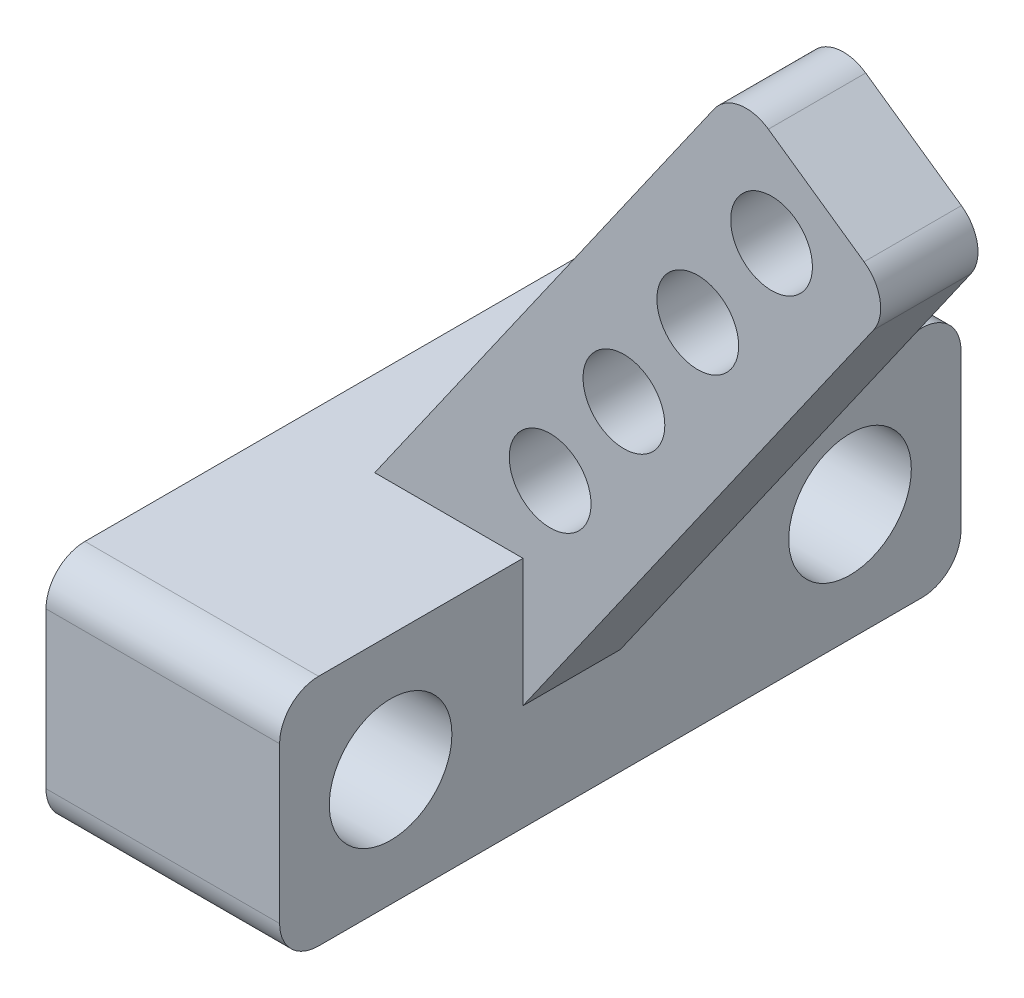
from build123d import *

# Parameters (mm, degrees)
SKETCH1_R           = 3.15
BOSS_EXTRUDE1_DEPTH = 12
SKETCH2_R           = 2.1
BOSS_EXTRUDE2_DEPTH = 5


with BuildPart() as part:
    # Sketch1 → Boss-Extrude1 (new body)
    with BuildSketch(Plane(origin=(0, 0, 0), x_dir=(0, 0, -1), z_dir=(1, 0, 0))):
        with BuildLine():
            Line((-15.5, -6), (15.5, -6))
            ThreePointArc((15.5, -6), (16.914213562, -5.414213562), (17.5, -4))
            Line((17.5, -4), (17.5, 4))
            ThreePointArc((17.5, 4), (16.914213562, 5.414213562), (15.5, 6))
            Line((15.5, 6), (-15.5, 6))
            ThreePointArc((-15.5, 6), (-16.914213562, 5.414213562), (-17.5, 4))
            Line((-17.5, 4), (-17.5, -4))
            ThreePointArc((-17.5, -4), (-16.914213562, -5.414213562), (-15.5, -6))
        make_face()
        with Locations((-11.8, 0)):
            Circle(SKETCH1_R, mode=Mode.SUBTRACT)
        with Locations((11.8, 0)):
            Circle(SKETCH1_R, mode=Mode.SUBTRACT)
    extrude(amount=BOSS_EXTRUDE1_DEPTH)

    # Sketch2 → Boss-Extrude2 (add)
    with BuildSketch(Plane.XY):
        with BuildLine():
            Line((30.012822222, 25.164048641), (8.191520443, -6))
            Line((8.191520443, -6), (0, -0.264235636))
            Line((0, -0.264235636), (21.82130178, 30.899813004))
            ThreePointArc((21.82130178, 30.899813004), (23.112309513, 31.722275638), (24.606758741, 31.39096422))
            Line((24.606758741, 31.39096422), (29.521671007, 27.949505602))
            ThreePointArc((29.521671007, 27.949505602), (30.34413364, 26.658497869), (30.012822222, 25.164048641))
        make_face()
        with Locations((24.769909128, 26.393626734)):
            Circle(SKETCH2_R, mode=Mode.SUBTRACT)
        with Locations((20.978568884, 20.979031721)):
            Circle(SKETCH2_R, mode=Mode.SUBTRACT)
        with Locations((17.18722864, 15.564436709)):
            Circle(SKETCH2_R, mode=Mode.SUBTRACT)
        with Locations((13.395888395, 10.149841696)):
            Circle(SKETCH2_R, mode=Mode.SUBTRACT)
    extrude(amount=BOSS_EXTRUDE2_DEPTH)


solid = part.part
